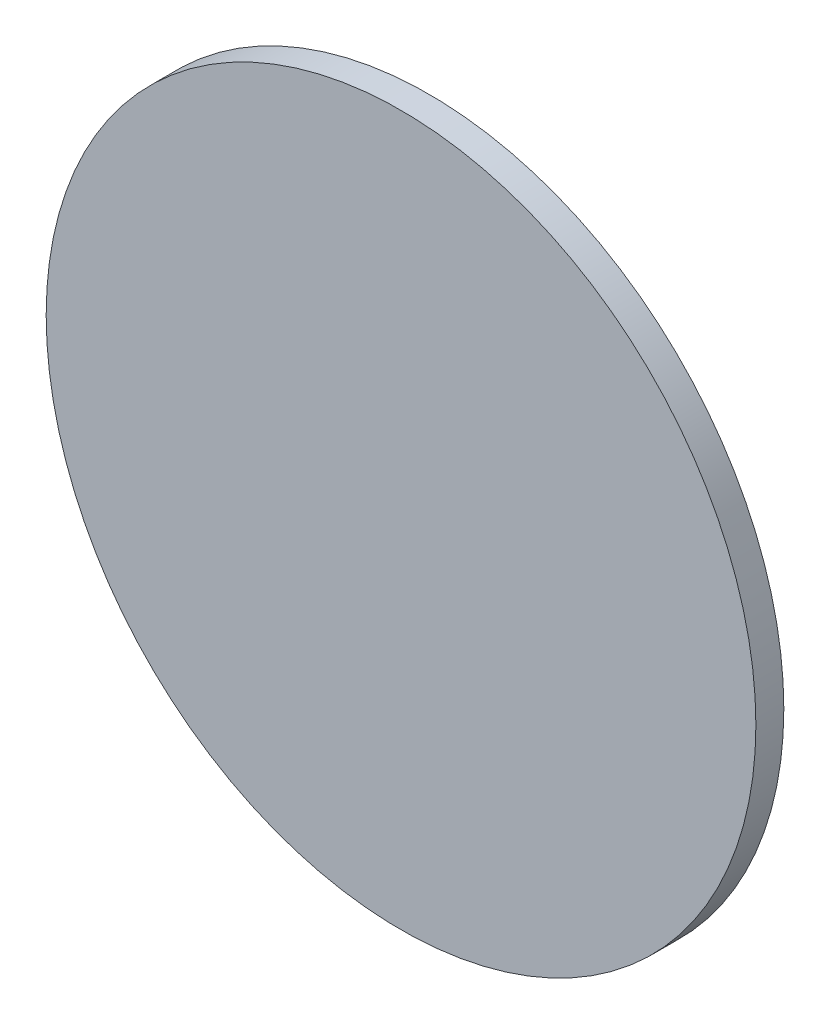
from build123d import *

# Parameters (mm, degrees)
SCHIZZO1_R                   = 63.5
ESTRUSIONE_ESTRUSIONE1_DEPTH = 5


with BuildPart() as part:
    # Schizzo1 → Estrusione-Estrusione1 (new body)
    with BuildSketch(Plane.XY):
        Circle(SCHIZZO1_R)
    extrude(amount=ESTRUSIONE_ESTRUSIONE1_DEPTH)


solid = part.part
